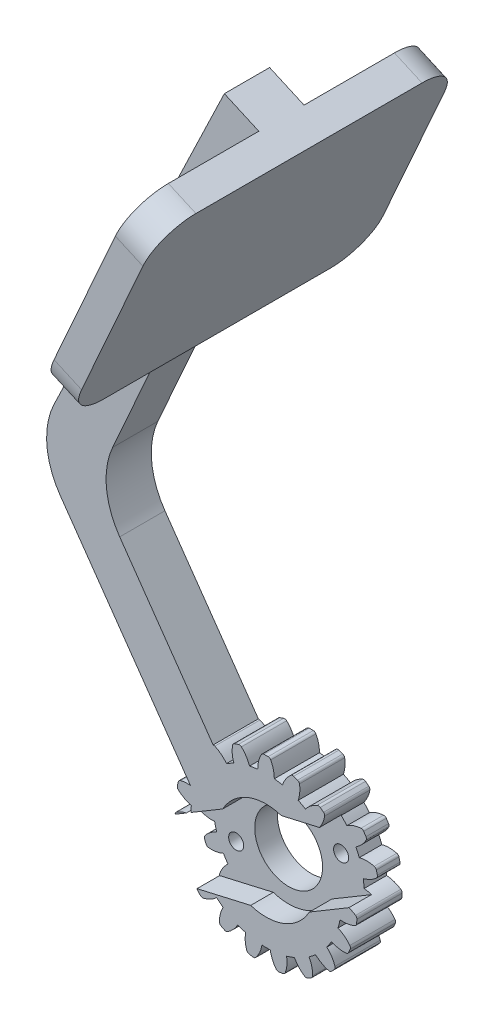
from build123d import *

# Parameters (mm, degrees)
SKETCH1_R                = 1.5
BOSS_EXTRUDE1_DEPTH      = 6
CIRPATTERN1_COUNT        = 19
BOSS_EXTRUDE2_DEPTH      = 6
CUT_EXTRUDE1_START       = -3
SKETCH4_R                = 1.5
CUT_EXTRUDE1_DEPTH       = 3
CUT_EXTRUDE2_DEPTH       = 91.375157354
CUT_EXTRUDE2_DEPTH_BACK  = 91.375157354
SKETCH5_R                = 4.5
CUT_EXTRUDE3_DEPTH       = 91.225656364
CUT_EXTRUDE3_DEPTH_BACK  = 91.225656364
SKETCH6_R                = 1
BOSS_EXTRUDE3_DEPTH      = 3
BOSS_EXTRUDE3_DEPTH_BACK = 1


with BuildPart() as part:
    # Sketch1 → Boss-Extrude1 (new body)
    with BuildSketch(Plane.XY):
        with BuildLine():
            ThreePointArc((-1.1, 9.939315872), (0, -10), (1.1, 9.939315872))
            add(Edge.make_bspline(
                [(0.617746857, 11.864626423), (0.963605173, 11.235441628), (1.059124761, 10.632766051), (1.1, 9.939315872)],
                knots=[0.104246354, 0.104246354, 0.104246354, 0.104246354, 1, 1, 1, 1], degree=3))
            ThreePointArc((0.617746857, 11.864626423), (0.474766739, 12.013880626), (0.276370143, 12.071836834))
            ThreePointArc((0.276370143, 12.071836834), (0, 12.075), (-0.276370142, 12.071836834))
            ThreePointArc((-0.276370142, 12.071836834), (-0.474766738, 12.013880627), (-0.617746856, 11.864626423))
            add(Edge.make_bspline(
                [(-0.617746856, 11.864626423), (-0.934550755, 11.28829737), (-1.120724213, 10.60048866), (-1.1, 9.939315872)],
                knots=[0.104246354, 0.104246354, 0.104246354, 0.104246354, 1, 1, 1, 1], degree=3))
        make_face()
        Circle(SKETCH1_R, mode=Mode.SUBTRACT)
    boss_extrude1 = extrude(amount=BOSS_EXTRUDE1_DEPTH)

    # CirPattern1: Boss-Extrude1 ×19 about axis
    cirpattern1_axis = Axis((0, 0, 6), (0, 0, -1))
    for i in range(1, CIRPATTERN1_COUNT):
        add(boss_extrude1.rotate(cirpattern1_axis, i * 360 / CIRPATTERN1_COUNT))

    # Sketch2 → Boss-Extrude2 (add)
    with BuildSketch(Plane.XY.offset(6)):
        with BuildLine():
            Line((-2.585087734, 3.441458618), (-19.415123668, 27.47724089))
            ThreePointArc((-19.415123668, 27.47724089), (-21.177565208, 32.254547728), (-20.359057801, 37.280371684))
            Line((-20.359057801, 37.280371684), (-0.044775905, 82.906995859))
            Line((-0.044775905, 82.906995859), (-5.52604865, 85.347415718))
            Line((-5.52604865, 85.347415718), (-28.123905723, 38.351095908))
            ThreePointArc((-28.123905723, 38.351095908), (-29.07858682, 33.20520575), (-27.303161981, 28.281846311))
            Line((-27.303161981, 28.281846311), (-7.5, 0))
            Line((-7.5, 0), (-2.585087734, 3.441458618))
        make_face()
    extrude(amount=-BOSS_EXTRUDE2_DEPTH)

    # Sketch4 → Cut-Extrude1 (cut)
    with BuildSketch(Plane.XY.offset(6).offset(CUT_EXTRUDE1_START)):
        with BuildLine():
            ThreePointArc((-2.034530077, -6.173385405), (2.420414621, -6.032544493), (5.737256394, -3.055141415))
            Line((5.737256394, -3.055141415), (10.989669758, 0.075054714))
            add(Edge.make_bspline(
                [(10.989669758, 0.075054714), (10.66744888, 0.187695941), (10.330615167, 0.258277336), (9.996205349, 0.275460743)],
                knots=[0.546568193, 0.546568193, 0.546568193, 0.546568193, 1, 1, 1, 1], degree=3))
            ThreePointArc((9.996205349, 0.275460743), (9.96584493, 0.825793455), (9.905209485, 1.373617506))
            add(Edge.make_bspline(
                [(11.653219898, 2.31374963), (11.128191187, 1.82401875), (10.567405996, 1.583473928), (9.905209485, 1.373617506)],
                knots=[0.104246354, 0.104246354, 0.104246354, 0.104246354, 1, 1, 1, 1], degree=3))
            ThreePointArc((11.653219898, 2.31374963), (11.762807418, 2.488994335), (11.770286696, 2.695547456))
            ThreePointArc((11.770286696, 2.695547456), (11.705508211, 2.964237257), (11.634596978, 3.231374035))
            ThreePointArc((11.634596978, 3.231374035), (11.52971073, 3.409472341), (11.349924122, 3.511437564))
            add(Edge.make_bspline(
                [(11.349924122, 3.511437564), (10.713459826, 3.677066929), (10.000994996, 3.688696473), (9.365141414, 3.506298091)],
                knots=[0.104246354, 0.104246354, 0.104246354, 0.104246354, 1, 1, 1, 1], degree=3))
            ThreePointArc((9.365141414, 3.506298091), (9.157733267, 4.016954247), (8.922505039, 4.515407383))
            add(Edge.make_bspline(
                [(10.270543024, 5.972178608), (9.932977174, 5.338506155), (9.480681647, 4.928908061), (8.922505039, 4.515407383)],
                knots=[0.104246354, 0.104246354, 0.104246354, 0.104246354, 1, 1, 1, 1], degree=3))
            ThreePointArc((10.270543024, 5.972178608), (10.317290928, 6.173511082), (10.257297269, 6.371301102))
            ThreePointArc((10.257297269, 6.371301102), (10.108785225, 6.604399009), (9.954976988, 6.83403674))
            ThreePointArc((9.954976988, 6.83403674), (9.797945341, 6.968428679), (9.594792013, 7.006492529))
            add(Edge.make_bspline(
                [(9.594792013, 7.006492529), (8.939033341, 6.956488019), (8.261395715, 6.73615049), (7.719219091, 6.357173635)],
                knots=[0.104246354, 0.104246354, 0.104246354, 0.104246354, 1, 1, 1, 1], degree=3))
            ThreePointArc((7.719219091, 6.357173635), (7.357239107, 6.772815716), (6.972908724, 7.167882806))
            add(Edge.make_bspline(
                [(7.084072765, 7.332751711), (7.04798882, 7.278022576), (7.010909437, 7.223130061), (6.972908724, 7.167882806)],
                knots=[0.913533389, 0.913533389, 0.913533389, 0.913533389, 1, 1, 1, 1], degree=3))
            Line((7.084072765, 7.332751711), (2.034530077, 6.173385405))
            ThreePointArc((2.034530077, 6.173385405), (-2.420414621, 6.032544493), (-5.737256394, 3.055141415))
            Line((-5.737256394, 3.055141415), (-9.986319648, 0.522895679))
            ThreePointArc((-9.986319648, 0.522895679), (-9.992028439, 0.399208812), (-9.996205349, 0.275460743))
            add(Edge.make_bspline(
                [(-10.57273532, 0.173418983), (-10.386903226, 0.214702242), (-10.195544231, 0.247054329), (-9.996205349, 0.275460743)],
                knots=[0.740356392, 0.740356392, 0.740356392, 0.740356392, 1, 1, 1, 1], degree=3))
            Line((-10.57273532, 0.173418983), (-12.053969281, -0.709328145))
            ThreePointArc((-12.053969281, -0.709328145), (-12.053744598, -0.71539522), (-12.053427856, -0.721458186))
            ThreePointArc((-12.053427856, -0.721458186), (-12.033757753, -0.997145596), (-12.007782925, -1.272310582))
            ThreePointArc((-12.007782925, -1.272310582), (-11.933641207, -1.465243568), (-11.773089577, -1.595410022))
            add(Edge.make_bspline(
                [(-11.773089577, -1.595410022), (-11.172567522, -1.863538998), (-10.471733944, -1.992277787), (-9.814530789, -1.917025141)],
                knots=[0.104246354, 0.104246354, 0.104246354, 0.104246354, 1, 1, 1, 1], degree=3))
            ThreePointArc((-9.814530789, -1.917025141), (-9.694002659, -2.454854871), (-9.544025328, -2.985227051))
            add(Edge.make_bspline(
                [(-11.113454495, -4.200250055), (-10.676193545, -3.630781581), (-10.162649109, -3.301215268), (-9.544025328, -2.985227051)],
                knots=[0.104246354, 0.104246354, 0.104246354, 0.104246354, 1, 1, 1, 1], degree=3))
            ThreePointArc((-11.113454495, -4.200250055), (-11.192703054, -4.391142164), (-11.166082798, -4.596109218))
            ThreePointArc((-11.166082798, -4.596109218), (-11.057962919, -4.850472252), (-10.944049555, -5.102294028))
            ThreePointArc((-10.944049555, -5.102294028), (-10.811279801, -5.260699595), (-10.617162323, -5.331682243))
            add(Edge.make_bspline(
                [(-10.617162323, -5.331682243), (-9.962116873, -5.390294059), (-9.257454975, -5.284497135), (-8.660295394, -4.999928369)],
                knots=[0.104246354, 0.104246354, 0.104246354, 0.104246354, 1, 1, 1, 1], degree=3))
            ThreePointArc((-8.660295394, -4.999928369), (-8.371664783, -5.469481581), (-8.057602071, -5.922419173))
            add(Edge.make_bspline(
                [(-8.057602071, -5.922419173), (-8.540105904, -6.422153091), (-8.918815079, -6.900610197), (-9.147477913, -7.581201697)],
                knots=[0.249403928, 0.249403928, 0.249403928, 0.249403928, 1.145157574, 1.145157574, 1.145157574, 1.145157574], degree=3))
            ThreePointArc((-9.147477913, -7.581201697), (-9.168047244, -7.694199594), (-9.155658882, -7.808384316))
            Line((-9.155658882, -7.808384316), (-2.034530077, -6.173385405))
        make_face()
        Circle(SKETCH4_R, mode=Mode.SUBTRACT)
    extrude(amount=CUT_EXTRUDE1_DEPTH, mode=Mode.SUBTRACT)

    # Sketch5 → Cut-Extrude2 (cut, two sides: drawn at the far end of the back side and taken through both)
    with BuildSketch(Plane(origin=(0, 0, 0), x_dir=(-1, 0, 0), z_dir=(0, 0, -1)).offset(-CUT_EXTRUDE2_DEPTH_BACK)):
        with Locations(Location((0, 0, 0), (0, 0, 180))):
            Circle(SKETCH5_R)
    extrude(amount=CUT_EXTRUDE2_DEPTH + CUT_EXTRUDE2_DEPTH_BACK, mode=Mode.SUBTRACT)

    # Sketch6 → Cut-Extrude3 (cut, two sides: drawn at the far end of the back side and taken through both)
    with BuildSketch(Plane.XY.offset(3).offset(-CUT_EXTRUDE3_DEPTH_BACK)):
        with Locations((-6.960628261, -2.792786102)):
            Circle(SKETCH6_R)
        with Locations((6.960628261, 2.792786102)):
            Circle(SKETCH6_R)
    extrude(amount=CUT_EXTRUDE3_DEPTH + CUT_EXTRUDE3_DEPTH_BACK, mode=Mode.SUBTRACT)

    # Sketch7 → Boss-Extrude3 (add, two sides: drawn at the far end of the back side and taken through both)
    with BuildSketch(Plane(origin=(-30.843320901, 13.732331215, 0), x_dir=(0, 0, -1), z_dir=(0.9135454576426005, -0.40673664307580126, 0)).offset(-BOSS_EXTRUDE3_DEPTH_BACK)):
        with BuildLine():
            Line((-18, 45.721097473), (12, 45.721097473))
            ThreePointArc((12, 45.721097473), (15.535533906, 47.185563567), (17, 50.721097473))
            Line((17, 50.721097473), (17, 70.721097473))
            ThreePointArc((17, 70.721097473), (15.535533906, 74.256631379), (12, 75.721097473))
            Line((12, 75.721097473), (-18, 75.721097473))
            ThreePointArc((-18, 75.721097473), (-21.535533906, 74.256631379), (-23, 70.721097473))
            Line((-23, 70.721097473), (-23, 50.721097473))
            ThreePointArc((-23, 50.721097473), (-21.535533906, 47.185563567), (-18, 45.721097473))
        make_face()
    extrude(amount=BOSS_EXTRUDE3_DEPTH + BOSS_EXTRUDE3_DEPTH_BACK)


solid = part.part
